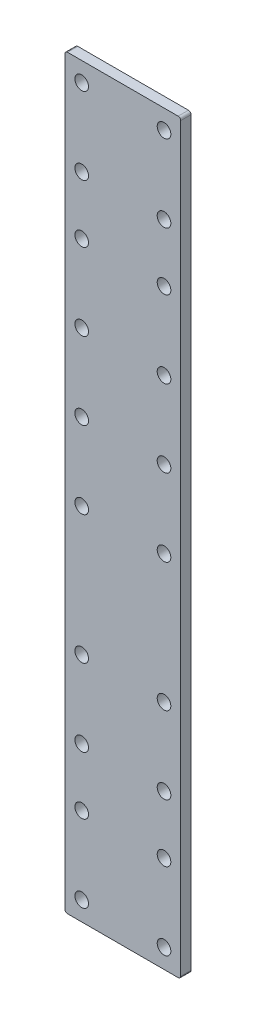
from build123d import *

# Parameters (mm, degrees)
SKETCH1_W            = 45
SKETCH1_H            = 290
BOSS_EXTRUDE1_DEPTH  = 4
M5_CLEARANCE_HOLE1_D = 5.3
FILLET1_R            = 1


with BuildPart() as part:
    # Sketch1 → Boss-Extrude1 (new body)
    with BuildSketch(Plane.XY):
        with Locations((0, 5)):
            Rectangle(SKETCH1_W, SKETCH1_H)
    extrude(amount=BOSS_EXTRUDE1_DEPTH)

    # M5 Clearance Hole1 (through all)
    with Locations(Plane.XY.offset(4)):
        with Locations((-16, 142.5), (-16, 112.5), (-16, -102.5), (-16, -132.5), (16, -132.5), (16, -102.5), (16, 112.5), (16, 142.5), (-16, 30), (-16, 0), (16, 0), (16, 30), (-16, 90), (-16, 60), (-16, -50), (-16, -80), (16, -80), (16, -50), (16, 60), (16, 90)):
            Hole(M5_CLEARANCE_HOLE1_D / 2)

    # Fillet1
    fillet1_edges = [part.edges().sort_by_distance(p)[0] for p in [
        (-22.5, 150, 2),
        (22.5, 150, 2),
        (22.5, -140, 2),
        (-22.5, -140, 2),
    ]]
    fillet(fillet1_edges, radius=FILLET1_R)


solid = part.part
